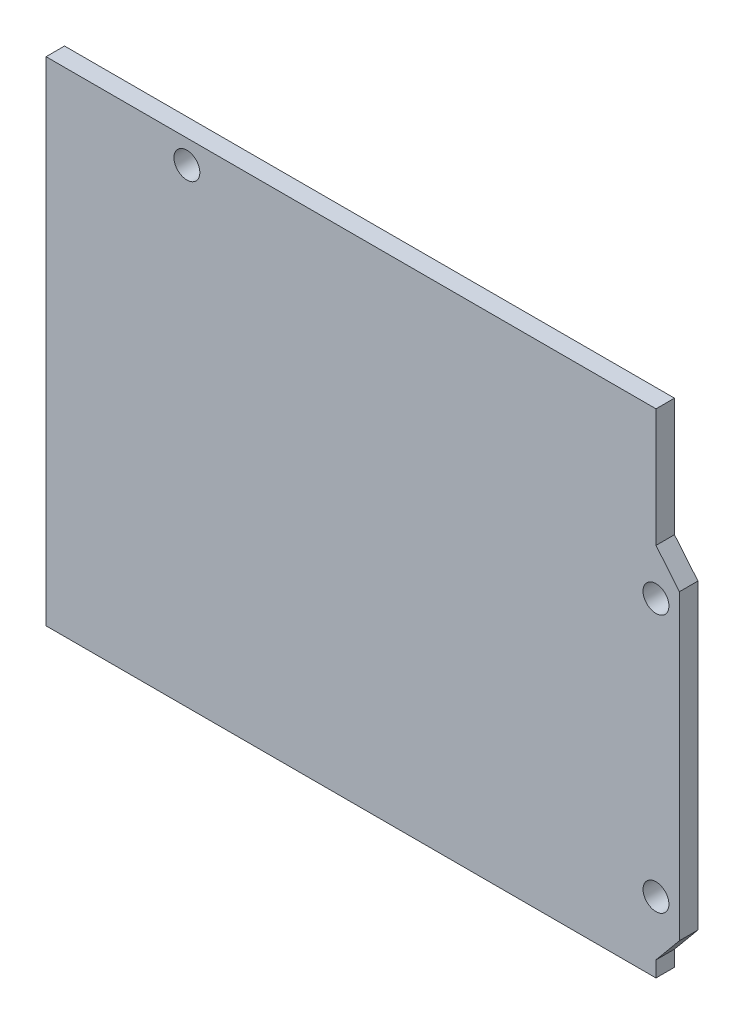
from build123d import *

# Parameters (mm, degrees)
SKETCH2_R           = 1.4
BOSS_EXTRUDE1_DEPTH = 2


with BuildPart() as part:
    # Sketch2 → Boss-Extrude1 (new body)
    with BuildSketch(Plane.XY):
        Polygon((0, 0), (0, 53.34), (66, 53.34), (66, 40.54), (68.54, 37.473610341), (68.54, 4.765453974), (66, 1.699064314), (66, 0), align=None)
        with Locations((15.24, 50.8)):
            Circle(SKETCH2_R, mode=Mode.SUBTRACT)
        with Locations((66, 35.56)):
            Circle(SKETCH2_R, mode=Mode.SUBTRACT)
        with Locations((66, 7.62)):
            Circle(SKETCH2_R, mode=Mode.SUBTRACT)
    extrude(amount=-BOSS_EXTRUDE1_DEPTH)


solid = part.part
